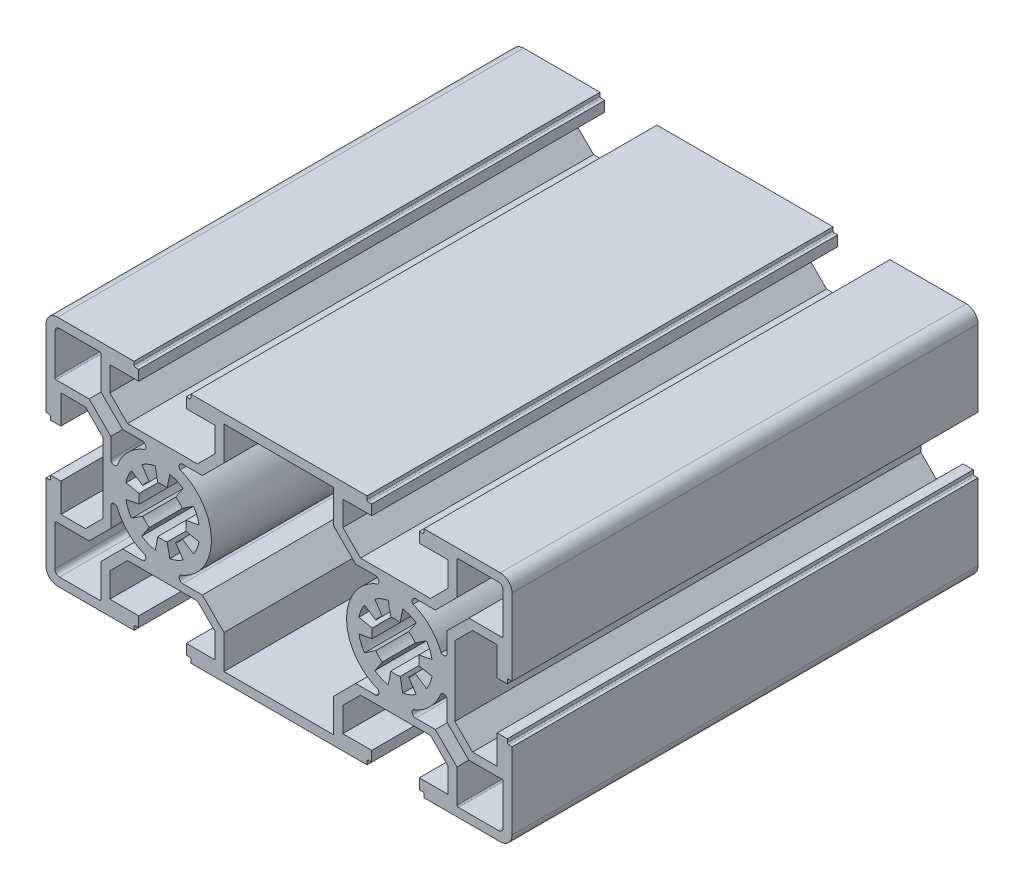
from build123d import *

# Parameters (mm, degrees)
EXTRUDE_1_DEPTH = 100


with BuildPart() as part:
    # 草图1 → 凸台-拉伸1 (new body)
    with BuildSketch(Plane.XY):
        with BuildLine():
            Line((-30.977197952, 25.151402525), (-47.377197952, 25.151402525))
            ThreePointArc((-47.377197952, 25.151402525), (-49.144964905, 24.419169478), (-49.877197952, 22.651402525))
            Line((-49.877197952, 22.651402525), (-49.877197952, 6.251402525))
            Line((-49.877197952, 6.251402525), (-49.177197952, 6.251402525))
            ThreePointArc((-49.177197952, 6.251402525), (-48.965065918, 6.163534559), (-48.877197952, 5.951402525))
            Line((-48.877197952, 5.951402525), (-48.877197952, 5.251402525))
            Line((-48.877197952, 5.251402525), (-46.677197952, 5.251402525))
            Line((-46.677197952, 5.251402525), (-46.677197952, 11.451402525))
            Line((-46.677197952, 11.451402525), (-41.409788133, 11.451402525))
            Line((-41.409788133, 11.451402525), (-37.609788133, 7.651402525))
            Line((-37.609788133, 7.651402525), (-37.609788133, 0.151402525))
            Line((-37.609788133, 0.151402525), (-37.609788133, -7.348597475))
            Line((-37.609788133, -7.348597475), (-41.409788133, -11.148597475))
            Line((-41.409788133, -11.148597475), (-46.677197952, -11.148597475))
            Line((-46.677197952, -11.148597475), (-46.677197952, -4.948597475))
            Line((-46.677197952, -4.948597475), (-48.877197952, -4.948597475))
            Line((-48.877197952, -4.948597475), (-48.877197952, -5.648597475))
            ThreePointArc((-48.877197952, -5.648597475), (-48.965065918, -5.86072951), (-49.177197952, -5.948597475))
            Line((-49.177197952, -5.948597475), (-49.877197952, -5.948597475))
            Line((-49.877197952, -5.948597475), (-49.877197952, -22.348597475))
            ThreePointArc((-49.877197952, -22.348597475), (-49.144964905, -24.116364428), (-47.377197952, -24.848597475))
            Line((-47.377197952, -24.848597475), (-30.977197952, -24.848597475))
            Line((-30.977197952, -24.848597475), (-30.977197952, -24.148597475))
            ThreePointArc((-30.977197952, -24.148597475), (-30.889329987, -23.936465441), (-30.677197952, -23.848597475))
            Line((-30.677197952, -23.848597475), (-29.977197952, -23.848597475))
            Line((-29.977197952, -23.848597475), (-29.977197952, -21.648597475))
            Line((-29.977197952, -21.648597475), (-36.177197952, -21.648597475))
            Line((-36.177197952, -21.648597475), (-36.177197952, -16.381187656))
            Line((-36.177197952, -16.381187656), (-32.377197952, -12.581187656))
            Line((-32.377197952, -12.581187656), (-24.877197952, -12.581187656))
            Line((-24.877197952, -12.581187656), (-17.377197952, -12.581187656))
            Line((-17.377197952, -12.581187656), (-13.577197952, -16.381187656))
            Line((-13.577197952, -16.381187656), (-13.577197952, -21.648597475))
            Line((-13.577197952, -21.648597475), (-19.777197952, -21.648597475))
            Line((-19.777197952, -21.648597475), (-19.777197952, -23.848597475))
            Line((-19.777197952, -23.848597475), (-19.077197952, -23.848597475))
            ThreePointArc((-19.077197952, -23.848597475), (-18.865065918, -23.936465441), (-18.777197952, -24.148597475))
            Line((-18.777197952, -24.148597475), (-18.777197952, -24.848597475))
            Line((-18.777197952, -24.848597475), (2.622802048, -24.848597475))
            Line((2.622802048, -24.848597475), (19.022802048, -24.848597475))
            Line((19.022802048, -24.848597475), (19.022802048, -24.148597475))
            ThreePointArc((19.022802048, -24.148597475), (19.110670013, -23.936465441), (19.322802048, -23.848597475))
            Line((19.322802048, -23.848597475), (20.022802048, -23.848597475))
            Line((20.022802048, -23.848597475), (20.022802048, -21.648597475))
            Line((20.022802048, -21.648597475), (13.822802048, -21.648597475))
            Line((13.822802048, -21.648597475), (13.822802048, -16.381187656))
            Line((13.822802048, -16.381187656), (17.622802048, -12.581187656))
            Line((17.622802048, -12.581187656), (25.122802048, -12.581187656))
            Line((25.122802048, -12.581187656), (32.622802048, -12.581187656))
            Line((32.622802048, -12.581187656), (36.422802048, -16.381187656))
            Line((36.422802048, -16.381187656), (36.422802048, -21.648597475))
            Line((36.422802048, -21.648597475), (30.222802048, -21.648597475))
            Line((30.222802048, -21.648597475), (30.222802048, -23.848597475))
            Line((30.222802048, -23.848597475), (30.922802048, -23.848597475))
            ThreePointArc((30.922802048, -23.848597475), (31.134934082, -23.936465441), (31.222802048, -24.148597475))
            Line((31.222802048, -24.148597475), (31.222802048, -24.848597475))
            Line((31.222802048, -24.848597475), (47.622802048, -24.848597475))
            ThreePointArc((47.622802048, -24.848597475), (49.390569001, -24.116364428), (50.122802048, -22.348597475))
            Line((50.122802048, -22.348597475), (50.122802048, -5.948597475))
            Line((50.122802048, -5.948597475), (49.422802048, -5.948597475))
            ThreePointArc((49.422802048, -5.948597475), (49.210670013, -5.86072951), (49.122802048, -5.648597475))
            Line((49.122802048, -5.648597475), (49.122802048, -4.948597475))
            Line((49.122802048, -4.948597475), (46.922802048, -4.948597475))
            Line((46.922802048, -4.948597475), (46.922802048, -11.148597475))
            Line((46.922802048, -11.148597475), (41.655392228, -11.148597475))
            Line((41.655392228, -11.148597475), (37.855392228, -7.348597475))
            Line((37.855392228, -7.348597475), (37.855392228, 0.151402525))
            Line((37.855392228, 0.151402525), (37.855392228, 7.651402525))
            Line((37.855392228, 7.651402525), (41.655392228, 11.451402525))
            Line((41.655392228, 11.451402525), (46.922802048, 11.451402525))
            Line((46.922802048, 11.451402525), (46.922802048, 5.251402525))
            Line((46.922802048, 5.251402525), (49.122802048, 5.251402525))
            Line((49.122802048, 5.251402525), (49.122802048, 5.951402525))
            ThreePointArc((49.122802048, 5.951402525), (49.210670013, 6.163534559), (49.422802048, 6.251402525))
            Line((49.422802048, 6.251402525), (50.122802048, 6.251402525))
            Line((50.122802048, 6.251402525), (50.122802048, 22.651402525))
            ThreePointArc((50.122802048, 22.651402525), (49.390569001, 24.419169478), (47.622802048, 25.151402525))
            Line((47.622802048, 25.151402525), (31.222802048, 25.151402525))
            Line((31.222802048, 25.151402525), (31.222802048, 24.451402525))
            ThreePointArc((31.222802048, 24.451402525), (31.134934082, 24.23927049), (30.922802048, 24.151402525))
            Line((30.922802048, 24.151402525), (30.222802048, 24.151402525))
            Line((30.222802048, 24.151402525), (30.222802048, 21.951402525))
            Line((30.222802048, 21.951402525), (36.422802048, 21.951402525))
            Line((36.422802048, 21.951402525), (36.422802048, 16.683992705))
            Line((36.422802048, 16.683992705), (32.622802048, 12.883992705))
            Line((32.622802048, 12.883992705), (25.122802048, 12.883992705))
            Line((25.122802048, 12.883992705), (17.622802048, 12.883992705))
            Line((17.622802048, 12.883992705), (13.822802048, 16.683992705))
            Line((13.822802048, 16.683992705), (13.822802048, 21.951402525))
            Line((13.822802048, 21.951402525), (20.022802048, 21.951402525))
            Line((20.022802048, 21.951402525), (20.022802048, 24.151402525))
            Line((20.022802048, 24.151402525), (19.322802048, 24.151402525))
            ThreePointArc((19.322802048, 24.151402525), (19.110670013, 24.23927049), (19.022802048, 24.451402525))
            Line((19.022802048, 24.451402525), (19.022802048, 25.151402525))
            Line((19.022802048, 25.151402525), (2.622802048, 25.151402525))
            Line((2.622802048, 25.151402525), (-18.777197952, 25.151402525))
            Line((-18.777197952, 25.151402525), (-18.777197952, 24.451402525))
            ThreePointArc((-18.777197952, 24.451402525), (-18.865065918, 24.23927049), (-19.077197952, 24.151402525))
            Line((-19.077197952, 24.151402525), (-19.777197952, 24.151402525))
            Line((-19.777197952, 24.151402525), (-19.777197952, 21.951402525))
            Line((-19.777197952, 21.951402525), (-13.577197952, 21.951402525))
            Line((-13.577197952, 21.951402525), (-13.577197952, 16.683992705))
            Line((-13.577197952, 16.683992705), (-17.377197952, 12.883992705))
            Line((-17.377197952, 12.883992705), (-24.877197952, 12.883992705))
            Line((-24.877197952, 12.883992705), (-32.377197952, 12.883992705))
            Line((-32.377197952, 12.883992705), (-36.177197952, 16.683992705))
            Line((-36.177197952, 16.683992705), (-36.177197952, 21.951402525))
            Line((-36.177197952, 21.951402525), (-29.977197952, 21.951402525))
            Line((-29.977197952, 21.951402525), (-29.977197952, 24.151402525))
            Line((-29.977197952, 24.151402525), (-30.677197952, 24.151402525))
            ThreePointArc((-30.677197952, 24.151402525), (-30.889329987, 24.23927049), (-30.977197952, 24.451402525))
            Line((-30.977197952, 24.451402525), (-30.977197952, 25.151402525))
        make_face()
        with BuildLine():
            Line((-38.077197952, 15.896986937), (-38.077197952, 22.951402525))
            ThreePointArc((-38.077197952, 22.951402525), (-38.165065918, 23.163534559), (-38.377197952, 23.251402525))
            Line((-38.377197952, 23.251402525), (-46.977197952, 23.251402525))
            ThreePointArc((-46.977197952, 23.251402525), (-47.684304734, 22.958509306), (-47.977197952, 22.251402525))
            Line((-47.977197952, 22.251402525), (-47.977197952, 13.651402525))
            ThreePointArc((-47.977197952, 13.651402525), (-47.889329987, 13.43927049), (-47.677197952, 13.351402525))
            Line((-47.677197952, 13.351402525), (-40.622782365, 13.351402525))
            Line((-40.622782365, 13.351402525), (-35.977197952, 8.705818112))
            Line((-35.977197952, 8.705818112), (-35.977197952, 4.483488541))
            ThreePointArc((-35.977197952, 4.483488541), (-35.506363023, 3.775534768), (-34.671418566, 3.936008525))
            ThreePointArc((-34.671418566, 3.936008525), (-32.301819155, 7.576023727), (-28.661803953, 9.945623138))
            ThreePointArc((-28.661803953, 9.945623138), (-28.501330196, 10.780567595), (-29.209283968, 11.251402525))
            Line((-29.209283968, 11.251402525), (-33.43161354, 11.251402525))
            Line((-33.43161354, 11.251402525), (-38.077197952, 15.896986937))
        make_face(mode=Mode.SUBTRACT)
        with BuildLine():
            Line((-29.321759817, -6.500354374), (-27.710606141, -4.089092498))
            ThreePointArc((-27.710606141, -4.089092498), (-28.483442536, -3.45484206), (-29.117692975, -2.682005664))
            Line((-29.117692975, -2.682005664), (-31.528954851, -4.29315934))
            ThreePointArc((-31.528954851, -4.29315934), (-32.268234212, -2.910064934), (-32.723480196, -1.409320052))
            Line((-32.723480196, -1.409320052), (-29.879202882, -0.843558118))
            ThreePointArc((-29.879202882, -0.843558118), (-29.977197952, 0.151402525), (-29.879202882, 1.146363167))
            Line((-29.879202882, 1.146363167), (-32.723480196, 1.712125101))
            ThreePointArc((-32.723480196, 1.712125101), (-32.268234212, 3.212869983), (-31.528954851, 4.595964389))
            Line((-31.528954851, 4.595964389), (-29.117692975, 2.984810713))
            ThreePointArc((-29.117692975, 2.984810713), (-28.483442536, 3.757647109), (-27.710606141, 4.391897547))
            Line((-27.710606141, 4.391897547), (-29.321759817, 6.803159423))
            ThreePointArc((-29.321759817, 6.803159423), (-27.938665411, 7.542438785), (-26.437920528, 7.997684768))
            Line((-26.437920528, 7.997684768), (-25.872158595, 5.153407455))
            ThreePointArc((-25.872158595, 5.153407455), (-24.877197952, 5.251402525), (-23.88223731, 5.153407455))
            Line((-23.88223731, 5.153407455), (-23.316475376, 7.997684768))
            ThreePointArc((-23.316475376, 7.997684768), (-21.815730493, 7.542438785), (-20.432636088, 6.803159423))
            Line((-20.432636088, 6.803159423), (-22.043789764, 4.391897547))
            ThreePointArc((-22.043789764, 4.391897547), (-21.270953368, 3.757647109), (-20.63670293, 2.984810713))
            Line((-20.63670293, 2.984810713), (-18.225441054, 4.595964389))
            ThreePointArc((-18.225441054, 4.595964389), (-17.486161692, 3.212869983), (-17.030915709, 1.712125101))
            Line((-17.030915709, 1.712125101), (-19.875193022, 1.146363167))
            ThreePointArc((-19.875193022, 1.146363167), (-19.777197952, 0.151402525), (-19.875193022, -0.843558118))
            Line((-19.875193022, -0.843558118), (-17.030915709, -1.409320052))
            ThreePointArc((-17.030915709, -1.409320052), (-17.486161692, -2.910064934), (-18.225441054, -4.29315934))
            Line((-18.225441054, -4.29315934), (-20.63670293, -2.682005664))
            ThreePointArc((-20.63670293, -2.682005664), (-21.270953368, -3.45484206), (-22.043789764, -4.089092498))
            Line((-22.043789764, -4.089092498), (-20.432636088, -6.500354374))
            ThreePointArc((-20.432636088, -6.500354374), (-21.815730493, -7.239633736), (-23.316475376, -7.694879719))
            Line((-23.316475376, -7.694879719), (-23.88223731, -4.850602406))
            ThreePointArc((-23.88223731, -4.850602406), (-24.877197952, -4.948597475), (-25.872158595, -4.850602406))
            Line((-25.872158595, -4.850602406), (-26.437920528, -7.694879719))
            ThreePointArc((-26.437920528, -7.694879719), (-27.938665411, -7.239633736), (-29.321759817, -6.500354374))
        make_face(mode=Mode.SUBTRACT)
        with BuildLine():
            Line((-11.677197952, 23.151402525), (2.622802048, 23.151402525))
            Line((2.622802048, 23.151402525), (11.822802048, 23.151402525))
            Line((11.822802048, 23.151402525), (11.822802048, 15.996986937))
            Line((11.822802048, 15.996986937), (16.56838646, 11.251402525))
            Line((16.56838646, 11.251402525), (20.790716032, 11.251402525))
            ThreePointArc((20.790716032, 11.251402525), (21.498669804, 10.780567595), (21.338196047, 9.945623138))
            ThreePointArc((21.338196047, 9.945623138), (17.698180845, 7.576023727), (15.328581434, 3.936008525))
            ThreePointArc((15.328581434, 3.936008525), (15.521121668, -4.09803672), (21.338196047, -9.642818089))
            ThreePointArc((21.338196047, -9.642818089), (21.498669804, -10.477762546), (20.790716032, -10.948597475))
            Line((20.790716032, -10.948597475), (16.56838646, -10.948597475))
            Line((16.56838646, -10.948597475), (11.822802048, -15.694181888))
            Line((11.822802048, -15.694181888), (11.822802048, -22.848597475))
            Line((11.822802048, -22.848597475), (2.622802048, -22.848597475))
            Line((2.622802048, -22.848597475), (-11.677197952, -22.848597475))
            Line((-11.677197952, -22.848597475), (-11.677197952, -15.594181888))
            Line((-11.677197952, -15.594181888), (-16.322782365, -10.948597475))
            Line((-16.322782365, -10.948597475), (-20.545111936, -10.948597475))
            ThreePointArc((-20.545111936, -10.948597475), (-21.253065709, -10.477762546), (-21.092591952, -9.642818089))
            ThreePointArc((-21.092591952, -9.642818089), (-15.275517573, -4.09803672), (-15.082977339, 3.936008525))
            ThreePointArc((-15.082977339, 3.936008525), (-17.45257675, 7.576023727), (-21.092591952, 9.945623138))
            ThreePointArc((-21.092591952, 9.945623138), (-21.253065709, 10.780567595), (-20.545111936, 11.251402525))
            Line((-20.545111936, 11.251402525), (-16.322782365, 11.251402525))
            Line((-16.322782365, 11.251402525), (-11.677197952, 15.896986937))
            Line((-11.677197952, 15.896986937), (-11.677197952, 23.151402525))
        make_face(mode=Mode.SUBTRACT)
        with BuildLine():
            Line((-38.077197952, -15.594181888), (-38.077197952, -22.648597475))
            ThreePointArc((-38.077197952, -22.648597475), (-38.165065918, -22.86072951), (-38.377197952, -22.948597475))
            Line((-38.377197952, -22.948597475), (-46.977197952, -22.948597475))
            ThreePointArc((-46.977197952, -22.948597475), (-47.684304734, -22.655704257), (-47.977197952, -21.948597475))
            Line((-47.977197952, -21.948597475), (-47.977197952, -13.348597475))
            ThreePointArc((-47.977197952, -13.348597475), (-47.889329987, -13.136465441), (-47.677197952, -13.048597475))
            Line((-47.677197952, -13.048597475), (-40.622782365, -13.048597475))
            Line((-40.622782365, -13.048597475), (-35.977197952, -8.403013063))
            Line((-35.977197952, -8.403013063), (-35.977197952, -4.180683491))
            ThreePointArc((-35.977197952, -4.180683491), (-35.506363023, -3.472729719), (-34.671418566, -3.633203476))
            ThreePointArc((-34.671418566, -3.633203476), (-32.301819155, -7.273218678), (-28.661803953, -9.642818089))
            ThreePointArc((-28.661803953, -9.642818089), (-28.501330196, -10.477762546), (-29.209283968, -10.948597475))
            Line((-29.209283968, -10.948597475), (-33.43161354, -10.948597475))
            Line((-33.43161354, -10.948597475), (-38.077197952, -15.594181888))
        make_face(mode=Mode.SUBTRACT)
        with BuildLine():
            Line((20.678240183, -6.500354374), (22.289393859, -4.089092498))
            ThreePointArc((22.289393859, -4.089092498), (21.516557464, -3.45484206), (20.882307025, -2.682005664))
            Line((20.882307025, -2.682005664), (18.471045149, -4.29315934))
            ThreePointArc((18.471045149, -4.29315934), (17.731765788, -2.910064934), (17.276519804, -1.409320052))
            Line((17.276519804, -1.409320052), (20.120797118, -0.843558118))
            ThreePointArc((20.120797118, -0.843558118), (20.022802048, 0.151402525), (20.120797118, 1.146363167))
            Line((20.120797118, 1.146363167), (17.276519804, 1.712125101))
            ThreePointArc((17.276519804, 1.712125101), (17.731765788, 3.212869983), (18.471045149, 4.595964389))
            Line((18.471045149, 4.595964389), (20.882307025, 2.984810713))
            ThreePointArc((20.882307025, 2.984810713), (21.516557464, 3.757647109), (22.289393859, 4.391897547))
            Line((22.289393859, 4.391897547), (20.678240183, 6.803159423))
            ThreePointArc((20.678240183, 6.803159423), (22.061334589, 7.542438785), (23.562079472, 7.997684768))
            Line((23.562079472, 7.997684768), (24.127841405, 5.153407455))
            ThreePointArc((24.127841405, 5.153407455), (25.122802048, 5.251402525), (26.11776269, 5.153407455))
            Line((26.11776269, 5.153407455), (26.683524624, 7.997684768))
            ThreePointArc((26.683524624, 7.997684768), (28.184269507, 7.542438785), (29.567363912, 6.803159423))
            Line((29.567363912, 6.803159423), (27.956210236, 4.391897547))
            ThreePointArc((27.956210236, 4.391897547), (28.729046632, 3.757647109), (29.36329707, 2.984810713))
            Line((29.36329707, 2.984810713), (31.774558946, 4.595964389))
            ThreePointArc((31.774558946, 4.595964389), (32.513838308, 3.212869983), (32.969084291, 1.712125101))
            Line((32.969084291, 1.712125101), (30.124806978, 1.146363167))
            ThreePointArc((30.124806978, 1.146363167), (30.222802048, 0.151402525), (30.124806978, -0.843558118))
            Line((30.124806978, -0.843558118), (32.969084291, -1.409320052))
            ThreePointArc((32.969084291, -1.409320052), (32.513838308, -2.910064934), (31.774558946, -4.29315934))
            Line((31.774558946, -4.29315934), (29.36329707, -2.682005664))
            ThreePointArc((29.36329707, -2.682005664), (28.729046632, -3.45484206), (27.956210236, -4.089092498))
            Line((27.956210236, -4.089092498), (29.567363912, -6.500354374))
            ThreePointArc((29.567363912, -6.500354374), (28.184269507, -7.239633736), (26.683524624, -7.694879719))
            Line((26.683524624, -7.694879719), (26.11776269, -4.850602406))
            ThreePointArc((26.11776269, -4.850602406), (25.122802048, -4.948597475), (24.127841405, -4.850602406))
            Line((24.127841405, -4.850602406), (23.562079472, -7.694879719))
            ThreePointArc((23.562079472, -7.694879719), (22.061334589, -7.239633736), (20.678240183, -6.500354374))
        make_face(mode=Mode.SUBTRACT)
        with BuildLine():
            Line((38.322802048, 15.896986937), (38.322802048, 22.951402525))
            ThreePointArc((38.322802048, 22.951402525), (38.410670013, 23.163534559), (38.622802048, 23.251402525))
            Line((38.622802048, 23.251402525), (47.222802048, 23.251402525))
            ThreePointArc((47.222802048, 23.251402525), (47.929908829, 22.958509306), (48.222802048, 22.251402525))
            Line((48.222802048, 22.251402525), (48.222802048, 13.651402525))
            ThreePointArc((48.222802048, 13.651402525), (48.134934082, 13.43927049), (47.922802048, 13.351402525))
            Line((47.922802048, 13.351402525), (40.86838646, 13.351402525))
            Line((40.86838646, 13.351402525), (36.222802048, 8.705818112))
            Line((36.222802048, 8.705818112), (36.222802048, 4.483488541))
            ThreePointArc((36.222802048, 4.483488541), (35.751967119, 3.775534768), (34.917022661, 3.936008525))
            ThreePointArc((34.917022661, 3.936008525), (32.54742325, 7.576023727), (28.907408048, 9.945623138))
            ThreePointArc((28.907408048, 9.945623138), (28.746934291, 10.780567595), (29.454888064, 11.251402525))
            Line((29.454888064, 11.251402525), (33.677217635, 11.251402525))
            Line((33.677217635, 11.251402525), (38.322802048, 15.896986937))
        make_face(mode=Mode.SUBTRACT)
        with BuildLine():
            Line((38.322802048, -15.594181888), (38.322802048, -22.648597475))
            ThreePointArc((38.322802048, -22.648597475), (38.410670013, -22.86072951), (38.622802048, -22.948597475))
            Line((38.622802048, -22.948597475), (47.222802048, -22.948597475))
            ThreePointArc((47.222802048, -22.948597475), (47.929908829, -22.655704257), (48.222802048, -21.948597475))
            Line((48.222802048, -21.948597475), (48.222802048, -13.348597475))
            ThreePointArc((48.222802048, -13.348597475), (48.134934082, -13.136465441), (47.922802048, -13.048597475))
            Line((47.922802048, -13.048597475), (40.86838646, -13.048597475))
            Line((40.86838646, -13.048597475), (36.222802048, -8.403013063))
            Line((36.222802048, -8.403013063), (36.222802048, -4.180683491))
            ThreePointArc((36.222802048, -4.180683491), (35.751967119, -3.472729719), (34.917022661, -3.633203476))
            ThreePointArc((34.917022661, -3.633203476), (32.54742325, -7.273218678), (28.907408048, -9.642818089))
            ThreePointArc((28.907408048, -9.642818089), (28.746934291, -10.477762546), (29.454888064, -10.948597475))
            Line((29.454888064, -10.948597475), (33.677217635, -10.948597475))
            Line((33.677217635, -10.948597475), (38.322802048, -15.594181888))
        make_face(mode=Mode.SUBTRACT)
    extrude(amount=EXTRUDE_1_DEPTH)


solid = part.part
